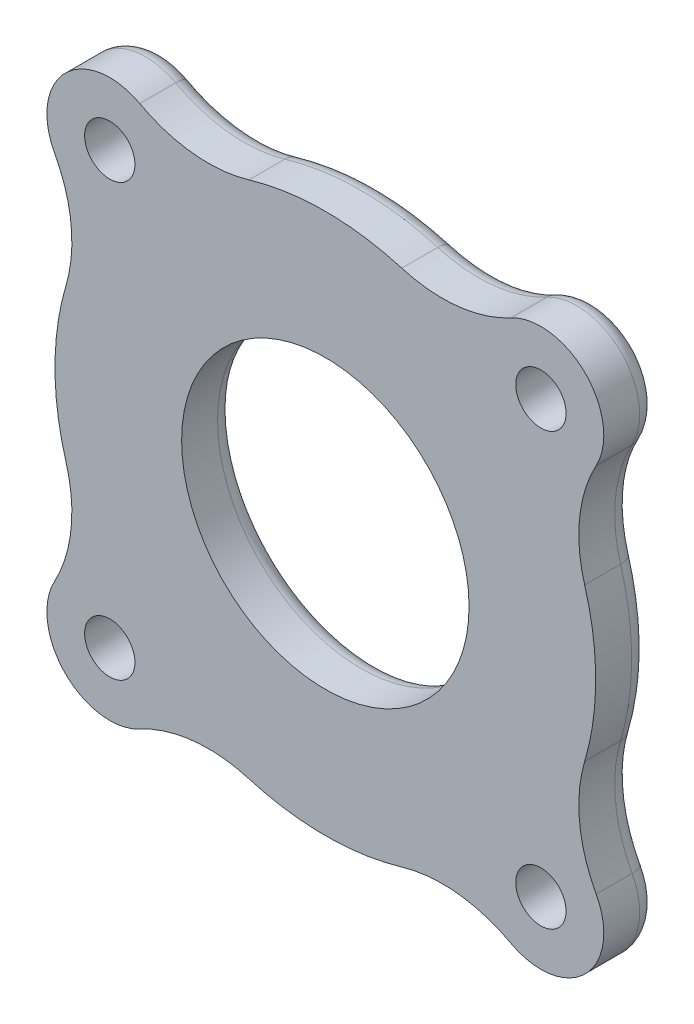
from build123d import *

# Parameters (mm, degrees)
SKETCH2_R           = 8
SKETCH2_R_2         = 1.4
BOSS_EXTRUDE1_DEPTH = 3
FILLET1_R           = 1


with BuildPart() as part:
    # Sketch2 → Boss-Extrude1 (new body)
    with BuildSketch(Plane.XY):
        with BuildLine():
            ThreePointArc((2.368452446, -25.752812678), (1.754211193, -30.008558133), (2.368452446, -34.264303588))
            ThreePointArc((2.368452446, -34.264303588), (2.650810328, -37.36580095), (1.727482394, -40.34010379))
            ThreePointArc((1.727482394, -40.34010379), (2.329337459, -44.483431868), (6.472665536, -45.085286933))
            ThreePointArc((6.472665536, -45.085286933), (9.446968377, -44.161958999), (12.548465738, -44.444316881))
            ThreePointArc((12.548465738, -44.444316881), (16.804211193, -45.058558133), (21.059956649, -44.444316881))
            ThreePointArc((21.059956649, -44.444316881), (24.16145401, -44.161958999), (27.135756851, -45.085286933))
            ThreePointArc((27.135756851, -45.085286933), (31.279084928, -44.483431868), (31.880939993, -40.34010379))
            ThreePointArc((31.880939993, -40.34010379), (30.957612059, -37.36580095), (31.239969941, -34.264303588))
            ThreePointArc((31.239969941, -34.264303588), (31.854211193, -30.008558133), (31.239969941, -25.752812678))
            ThreePointArc((31.239969941, -25.752812678), (30.957612059, -22.651315316), (31.880939993, -19.677012476))
            ThreePointArc((31.880939993, -19.677012476), (31.279084928, -15.533684399), (27.135756851, -14.931829334))
            ThreePointArc((27.135756851, -14.931829334), (24.16145401, -15.855157268), (21.059956649, -15.572799386))
            ThreePointArc((21.059956649, -15.572799386), (16.804211193, -14.958558133), (12.548465738, -15.572799386))
            ThreePointArc((12.548465738, -15.572799386), (9.446968377, -15.855157268), (6.472665536, -14.931829334))
            ThreePointArc((6.472665536, -14.931829334), (2.329337459, -15.533684399), (1.727482394, -19.677012476))
            ThreePointArc((1.727482394, -19.677012476), (2.650810328, -22.651315316), (2.368452446, -25.752812678))
        make_face()
        with Locations((16.804211193, -30.008558133)):
            Circle(SKETCH2_R, mode=Mode.SUBTRACT)
        with Locations((4.804211193, -18.008558133)):
            Circle(SKETCH2_R_2, mode=Mode.SUBTRACT)
        with Locations((28.804211193, -18.008558133)):
            Circle(SKETCH2_R_2, mode=Mode.SUBTRACT)
        with Locations((28.804211193, -42.008558133)):
            Circle(SKETCH2_R_2, mode=Mode.SUBTRACT)
        with Locations((4.804211193, -42.008558133)):
            Circle(SKETCH2_R_2, mode=Mode.SUBTRACT)
    extrude(amount=BOSS_EXTRUDE1_DEPTH)

    # Fillet1
    fillet1_edges = [part.edges().sort_by_distance(p)[0] for p in [
        (2.329337459, -15.533684399, 0),
        (9.446968377, -15.855157268, 0),
        (16.804211193, -14.958558133, 0),
        (24.16145401, -15.855157268, 0),
        (31.279084928, -15.533684399, 0),
        (30.957612059, -22.651315316, 0),
        (31.854211193, -30.008558133, 0),
        (30.957612059, -37.36580095, 0),
        (31.279084928, -44.483431868, 0),
        (24.16145401, -44.161958999, 0),
        (16.804211193, -45.058558133, 0),
        (9.446968377, -44.161958999, 0),
        (2.329337459, -44.483431868, 0),
        (2.650810328, -37.36580095, 0),
        (1.754211193, -30.008558133, 0),
        (2.650810328, -22.651315316, 0),
        (8.804211193, -30.008558133, 0),
    ]]
    fillet(fillet1_edges, radius=FILLET1_R)


solid = part.part
